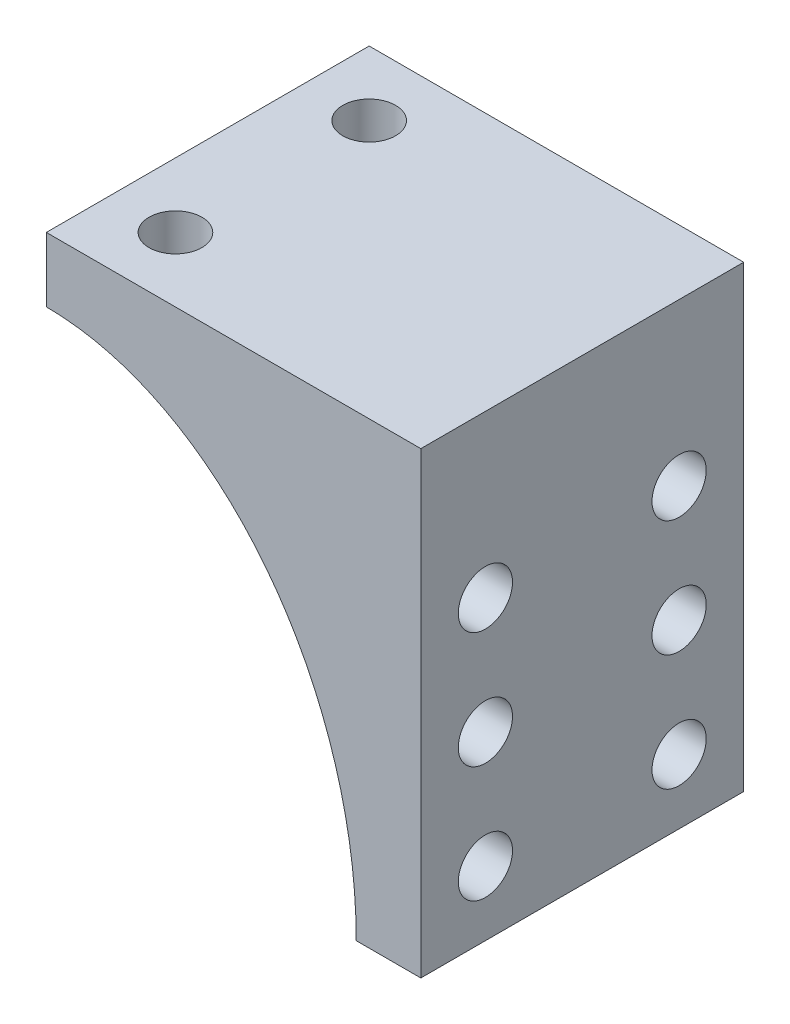
from build123d import *

# Parameters (mm, degrees)
EXTRUDE_1_DEPTH     = 25
SKETCH_2_R          = 2.1
CUT_EXTRUDE_1_DEPTH = 25
SKETCH_4_R          = 4
CUT_EXTRUDE_2_DEPTH = 24
SKETCH_5_R          = 2.044965575
CUT_EXTRUDE_3_DEPTH = 24
SKETCH_6_R          = 4
CUT_EXTRUDE_4_DEPTH = 30.5


with BuildPart() as part:
    # 草圖1 → 填料-伸長1 (new body)
    with BuildSketch(Plane.XY):
        with BuildLine():
            Line((-3.252259835, 16.056494785), (-32.252259835, 16.056494785))
            Line((-32.252259835, 16.056494785), (-32.252259835, 11.056494785))
            add(Edge.make_bspline(
                [(-8.252259835, -19.443505215), (-8.252259835, 11.056494785), (-32.252259835, 11.056494785)],
                knots=[4.71238898, 4.71238898, 4.71238898, 6.283185307, 6.283185307, 6.283185307], degree=2, weights=[1, 0.707106781, 1]))
            Line((-8.252259835, -19.443505215), (-3.252259835, -19.443505215))
            Line((-3.252259835, -19.443505215), (-3.252259835, 16.056494785))
        make_face()
    extrude(amount=EXTRUDE_1_DEPTH)

    # 草圖2 → 除料-伸長1 (cut)
    with BuildSketch(Plane(origin=(-3.252259835, 0, 0), x_dir=(0, 0, -1), z_dir=(1, 0, 0))):
        with Locations(Location((-20, -14.443505215, 0), (0, 0, 90))):
            Circle(SKETCH_2_R)
        with Locations(Location((-5, -14.443505215, 0), (0, 0, 90))):
            Circle(SKETCH_2_R)
        with Locations(Location((-5, -5.443505215, 0), (0, 0, 90))):
            Circle(SKETCH_2_R)
        with Locations(Location((-5, 3.556494785, 0), (0, 0, 90))):
            Circle(SKETCH_2_R)
        with Locations(Location((-20, -5.443505215, 0), (0, 0, 90))):
            Circle(SKETCH_2_R)
        with Locations(Location((-20, 3.556494785, 0), (0, 0, 90))):
            Circle(SKETCH_2_R)
    extrude(amount=-CUT_EXTRUDE_1_DEPTH, mode=Mode.SUBTRACT)

    # 草圖4 → 除料-伸長2 (cut)
    with BuildSketch(Plane.ZY.offset(32.252259835)):
        with Locations((5, 3.556494785)):
            Circle(SKETCH_4_R)
        with Locations((20, 3.556494785)):
            Circle(SKETCH_4_R)
        with Locations((20, -5.443505215)):
            Circle(SKETCH_4_R)
        with Locations((20, -14.443505215)):
            Circle(SKETCH_4_R)
        with Locations((5, -5.443505215)):
            Circle(SKETCH_4_R)
        with Locations((5, -14.443505215)):
            Circle(SKETCH_4_R)
    extrude(amount=-CUT_EXTRUDE_2_DEPTH, mode=Mode.SUBTRACT)

    # 草圖5 → 除料-伸長3 (cut)
    with BuildSketch(Plane(origin=(0, 16.056494785, 0), x_dir=(1, 0, 0), z_dir=(0, 1, 0))):
        with Locations(Location((-27.252259835, -5, 0), (0, 0, 270))):
            Circle(SKETCH_5_R)
        with Locations(Location((-27.252259835, -20, 0), (0, 0, 270))):
            Circle(SKETCH_5_R)
    extrude(amount=-CUT_EXTRUDE_3_DEPTH, mode=Mode.SUBTRACT)

    # 草圖6 → 除料-伸長4 (cut)
    with BuildSketch(Plane.XZ.offset(19.443505215)):
        with Locations(Location((-27.252259835, 5, 0), (0, 0, 270))):
            Circle(SKETCH_6_R)
        with Locations(Location((-27.252259835, 20, 0), (0, 0, 270))):
            Circle(SKETCH_6_R)
    extrude(amount=-CUT_EXTRUDE_4_DEPTH, mode=Mode.SUBTRACT)


solid = part.part
